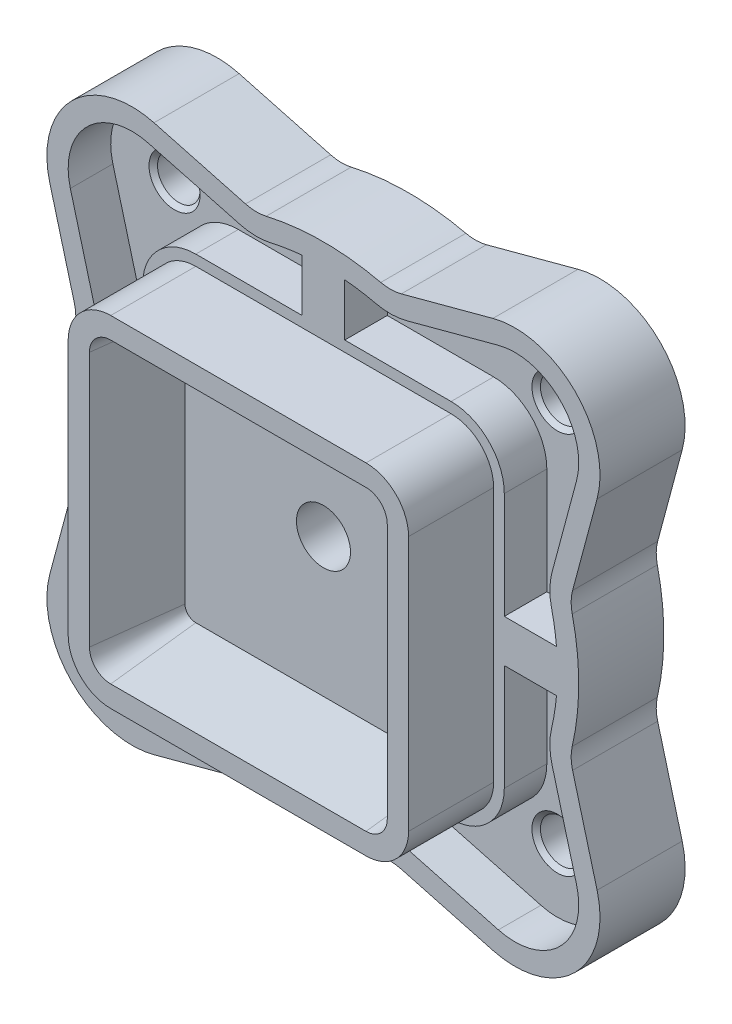
from build123d import *

# Parameters (mm, degrees)
BASE_EXTRUDE_DEPTH      = 25.4
BOSS_EXTRUDE1_DEPTH     = 25.4
CUT_EXTRUDE1_DEPTH      = 25.4
CUT_EXTRUDE1_DRAFT      = -7
CUT_EXTRUDE3_DEPTH      = 12.7
BOSS_EXTRUDE2_REACH     = 121.475
SKETCH6_W               = 25.134955719
SKETCH6_H               = 12.7
CIRPATTERN1_COUNT       = 4
CUT_EXTRUDE4_DEPTH      = 12.7
CUT_EXTRUDE4_DEPTH_BACK = 123.803155497
SKETCH7_R               = 6.35
CHAMFER1_SIZE           = 1.27
CUT_EXTRUDE5_START      = -3.175
SKETCH17_R              = 69.85
SKETCH17_R_2            = 50.8
CUT_EXTRUDE5_DEPTH      = 3.175
SKETCH28_R              = 8.0645
CUT_EXTRUDE6_DEPTH      = 120.474537036


with BuildPart() as part:
    # Sketch1 → Base-Extrude (new body)
    with BuildSketch(Plane.XY):
        with BuildLine():
            Line((-50.575996254, 81.684515988), (-23.24962088, 74.362435774))
            ThreePointArc((-23.24962088, 74.362435774), (-20.186868638, 73.931673761), (-17.110816292, 74.25402323))
            ThreePointArc((-17.110816292, 74.25402323), (0, 76.2), (17.110816292, 74.25402323))
            ThreePointArc((17.110816292, 74.25402323), (20.186868638, 73.931673761), (23.24962088, 74.362435774))
            Line((23.24962088, 74.362435774), (50.575996254, 81.684515988))
            ThreePointArc((50.575996254, 81.684515988), (75.110512242, 75.110512242), (81.684515988, 50.575996254))
            Line((81.684515988, 50.575996254), (74.362435774, 23.24962088))
            ThreePointArc((74.362435774, 23.24962088), (73.931673761, 20.186868638), (74.25402323, 17.110816292))
            ThreePointArc((74.25402323, 17.110816292), (76.2, 0), (74.25402323, -17.110816292))
            ThreePointArc((74.25402323, -17.110816292), (73.931673761, -20.186868638), (74.362435774, -23.24962088))
            Line((74.362435774, -23.24962088), (81.684515988, -50.575996254))
            ThreePointArc((81.684515988, -50.575996254), (75.110512242, -75.110512242), (50.575996254, -81.684515988))
            Line((50.575996254, -81.684515988), (23.24962088, -74.362435774))
            ThreePointArc((23.24962088, -74.362435774), (20.186868638, -73.931673761), (17.110816292, -74.25402323))
            ThreePointArc((17.110816292, -74.25402323), (0, -76.2), (-17.110816292, -74.25402323))
            ThreePointArc((-17.110816292, -74.25402323), (-20.186868638, -73.931673761), (-23.24962088, -74.362435774))
            Line((-23.24962088, -74.362435774), (-50.575996254, -81.684515988))
            ThreePointArc((-50.575996254, -81.684515988), (-75.110512242, -75.110512242), (-81.684515988, -50.575996254))
            Line((-81.684515988, -50.575996254), (-74.362435774, -23.24962088))
            ThreePointArc((-74.362435774, -23.24962088), (-73.931673761, -20.186868638), (-74.25402323, -17.110816292))
            ThreePointArc((-74.25402323, -17.110816292), (-76.2, 0), (-74.25402323, 17.110816292))
            ThreePointArc((-74.25402323, 17.110816292), (-73.931673761, 20.186868638), (-74.362435774, 23.24962088))
            Line((-74.362435774, 23.24962088), (-81.684515988, 50.575996254))
            ThreePointArc((-81.684515988, 50.575996254), (-75.110512242, 75.110512242), (-50.575996254, 81.684515988))
        make_face()
    extrude(amount=BASE_EXTRUDE_DEPTH)

    # Sketch2 → Boss-Extrude1 (add)
    with BuildSketch(Plane.XY.offset(25.4)):
        with BuildLine():
            Line((-38.1, 50.8), (38.1, 50.8))
            ThreePointArc((38.1, 50.8), (47.080256121, 47.080256121), (50.8, 38.1))
            Line((50.8, 38.1), (50.8, -38.1))
            ThreePointArc((50.8, -38.1), (47.080256121, -47.080256121), (38.1, -50.8))
            Line((38.1, -50.8), (-38.1, -50.8))
            ThreePointArc((-38.1, -50.8), (-47.080256121, -47.080256121), (-50.8, -38.1))
            Line((-50.8, -38.1), (-50.8, 38.1))
            ThreePointArc((-50.8, 38.1), (-47.080256121, 47.080256121), (-38.1, 50.8))
        make_face()
    extrude(amount=BOSS_EXTRUDE1_DEPTH)


with BuildPart() as cut_extrude1_tool:
    # Sketch3 → Cut-Extrude1 (with draft: the straight prism first)
    with BuildSketch(Plane.XY.offset(50.8)):
        with BuildLine():
            Line((-44.45, 38.1), (-44.45, -38.1))
            ThreePointArc((-44.45, -38.1), (-42.590128061, -42.590128061), (-38.1, -44.45))
            Line((-38.1, -44.45), (38.1, -44.45))
            ThreePointArc((38.1, -44.45), (42.590128061, -42.590128061), (44.45, -38.1))
            Line((44.45, -38.1), (44.45, 38.1))
            ThreePointArc((44.45, 38.1), (42.590128061, 42.590128061), (38.1, 44.45))
            Line((38.1, 44.45), (-38.1, 44.45))
            ThreePointArc((-38.1, 44.45), (-42.590128061, 42.590128061), (-44.45, 38.1))
        make_face()
    extrude(amount=-CUT_EXTRUDE1_DEPTH)
    # Cut-Extrude1: the draft: its side faces are tilted about the plane it starts from
    cut_extrude1_sides = [cut_extrude1_tool.faces().sort_by_distance(p)[0] for p in [
        (-42.590128061, 42.590128061, 38.1),
        (-44.45, 0, 38.1),
        (-42.590128061, -42.590128061, 38.1),
        (0, -44.45, 38.1),
        (42.590128061, -42.590128061, 38.1),
        (44.45, 0, 38.1),
        (42.590128061, 42.590128061, 38.1),
        (0, 44.45, 38.1),
    ]]
    draft(cut_extrude1_sides, Plane.XY.offset(50.8), CUT_EXTRUDE1_DRAFT)


with BuildPart() as part_1:
    add(part.part)

    # Cut-Extrude1: cut by cut_extrude1_tool
    add(cut_extrude1_tool.part, mode=Mode.SUBTRACT)

    # Sketch5 → Cut-Extrude3 (cut)
    with BuildSketch(Plane.XY.offset(25.4)):
        with BuildLine():
            Line((-75.550886991, 52.219497191), (-68.228806777, 24.893121817))
            ThreePointArc((-68.228806777, 24.893121817), (-67.582663757, 20.298993453), (-68.066187961, 15.684914935))
            ThreePointArc((-68.066187961, 15.684914935), (-69.85, 0), (-68.066187961, -15.684914935))
            ThreePointArc((-68.066187961, -15.684914935), (-67.582663757, -20.298993453), (-68.228806777, -24.893121817))
            Line((-68.228806777, -24.893121817), (-75.550886991, -52.219497191))
            ThreePointArc((-75.550886991, -52.219497191), (-70.620384182, -70.620384182), (-52.219497191, -75.550886991))
            Line((-52.219497191, -75.550886991), (-24.893121817, -68.228806777))
            ThreePointArc((-24.893121817, -68.228806777), (-20.298993453, -67.582663757), (-15.684914935, -68.066187961))
            ThreePointArc((-15.684914935, -68.066187961), (0, -69.85), (15.684914935, -68.066187961))
            ThreePointArc((15.684914935, -68.066187961), (20.298993453, -67.582663757), (24.893121817, -68.228806777))
            Line((24.893121817, -68.228806777), (52.219497191, -75.550886991))
            ThreePointArc((52.219497191, -75.550886991), (70.620384182, -70.620384182), (75.550886991, -52.219497191))
            Line((75.550886991, -52.219497191), (68.228806777, -24.893121817))
            ThreePointArc((68.228806777, -24.893121817), (67.582663757, -20.298993453), (68.066187961, -15.684914935))
            ThreePointArc((68.066187961, -15.684914935), (69.85, 0), (68.066187961, 15.684914935))
            ThreePointArc((68.066187961, 15.684914935), (67.582663757, 20.298993453), (68.228806777, 24.893121817))
            Line((68.228806777, 24.893121817), (75.550886991, 52.219497191))
            ThreePointArc((75.550886991, 52.219497191), (70.620384182, 70.620384182), (52.219497191, 75.550886991))
            Line((52.219497191, 75.550886991), (24.893121817, 68.228806777))
            ThreePointArc((24.893121817, 68.228806777), (20.298993453, 67.582663757), (15.684914935, 68.066187961))
            ThreePointArc((15.684914935, 68.066187961), (0, 69.85), (-15.684914935, 68.066187961))
            ThreePointArc((-15.684914935, 68.066187961), (-20.298993453, 67.582663757), (-24.893121817, 68.228806777))
            Line((-24.893121817, 68.228806777), (-52.219497191, 75.550886991))
            ThreePointArc((-52.219497191, 75.550886991), (-70.620384182, 70.620384182), (-75.550886991, 52.219497191))
        make_face()
        with BuildLine():
            Line((-53.975, 38.1), (-53.975, -38.1))
            ThreePointArc((-53.975, -38.1), (-49.325320151, -49.325320151), (-38.1, -53.975))
            Line((-38.1, -53.975), (38.1, -53.975))
            ThreePointArc((38.1, -53.975), (49.325320151, -49.325320151), (53.975, -38.1))
            Line((53.975, -38.1), (53.975, 38.1))
            ThreePointArc((53.975, 38.1), (49.325320151, 49.325320151), (38.1, 53.975))
            Line((38.1, 53.975), (-38.1, 53.975))
            ThreePointArc((-38.1, 53.975), (-49.325320151, 49.325320151), (-53.975, 38.1))
        make_face(mode=Mode.SUBTRACT)
    extrude(amount=-CUT_EXTRUDE3_DEPTH, mode=Mode.SUBTRACT)

    # Sketch6 → Boss-Extrude2 (add, up to next)
    with BuildSketch(Plane.XY.offset(25.4), mode=Mode.PRIVATE) as boss_extrude2_sk1:
        with Locations((63.367477859, 0)):
            Rectangle(SKETCH6_W, SKETCH6_H)
    boss_extrude2_tool1 = extrude(boss_extrude2_sk1.sketch, amount=-BOSS_EXTRUDE2_REACH, mode=Mode.PRIVATE) - part_1.part
    boss_extrude2 = boss_extrude2_tool1.solids().sort_by_distance((63.367478, 0, 25.4))[0]
    add(boss_extrude2)

    # CirPattern1: Boss-Extrude2 ×4 about axis
    cirpattern1_axis = Axis((0, 0, -50), (0, 0, 1))
    for i in range(1, CIRPATTERN1_COUNT):
        add(boss_extrude2.rotate(cirpattern1_axis, i * 360 / CIRPATTERN1_COUNT))

    # Sketch7 → Cut-Extrude4 (cut, two sides: drawn at the far end of the back side and taken through both)
    with BuildSketch(Plane.XY.offset(12.7).offset(-CUT_EXTRUDE4_DEPTH_BACK)):
        with Locations((57.15, 57.15)):
            Circle(SKETCH7_R)
        with Locations((-57.15, 57.15)):
            Circle(SKETCH7_R)
        with Locations((-57.15, -57.15)):
            Circle(SKETCH7_R)
        with Locations((57.15, -57.15)):
            Circle(SKETCH7_R)
    extrude(amount=CUT_EXTRUDE4_DEPTH + CUT_EXTRUDE4_DEPTH_BACK, mode=Mode.SUBTRACT)

    # Chamfer1
    chamfer1_edges = [part_1.edges().sort_by_distance(p)[0] for p in [
        (50.8, -57.15, 0),
        (-63.5, -57.15, 0),
        (50.8, 57.15, 0),
        (-63.5, 57.15, 0),
        (50.8, -57.15, 12.7),
        (-63.5, -57.15, 12.7),
        (50.8, 57.15, 12.7),
        (-63.5, 57.15, 12.7),
    ]]
    chamfer(chamfer1_edges, length=CHAMFER1_SIZE)

    # Sketch17 → Cut-Extrude5 (cut)
    with BuildSketch(Plane(origin=(0, 0, 0), x_dir=(-1, 0, 0), z_dir=(0, 0, -1)).offset(CUT_EXTRUDE5_START)):
        Circle(SKETCH17_R)
        Circle(SKETCH17_R_2, mode=Mode.SUBTRACT)
    extrude(amount=CUT_EXTRUDE5_DEPTH, mode=Mode.SUBTRACT)

    # Sketch28 → Cut-Extrude6 (cut, through all)
    with BuildSketch(Plane.XY.offset(25.4)):
        Circle(SKETCH28_R)
    extrude(amount=-CUT_EXTRUDE6_DEPTH, mode=Mode.SUBTRACT)


solid = part_1.part
